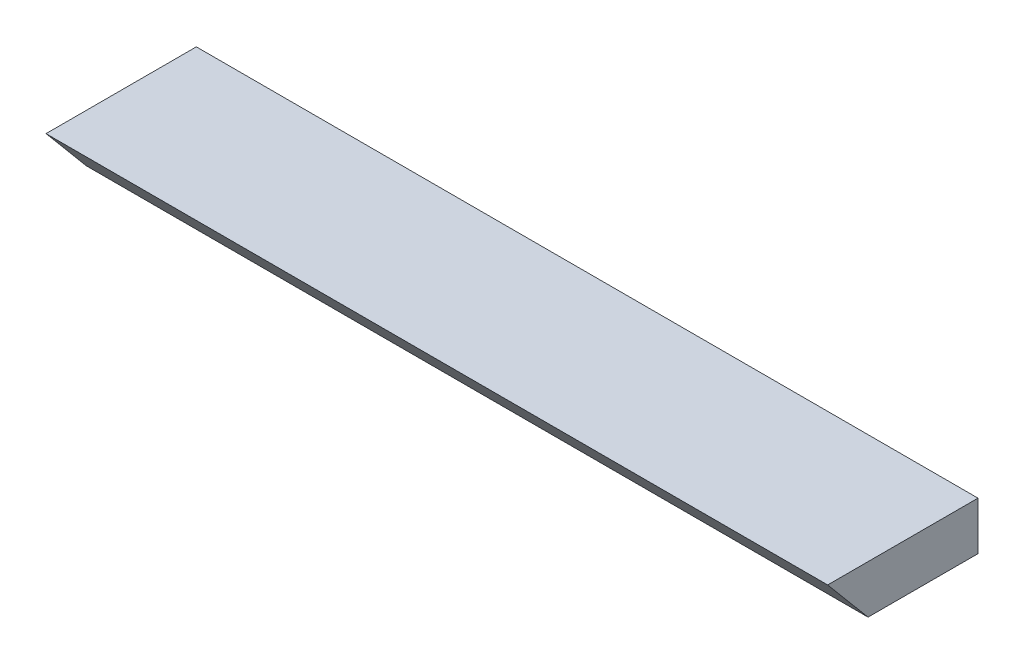
from build123d import *

# Parameters (mm, degrees)
EXTRUDE_1_DEPTH = 130


with BuildPart() as part:
    # Эскиз1 → Бобышка-Вытянуть1 (new body)
    with BuildSketch(Plane(origin=(0, 0, 0), x_dir=(0, 0, -1), z_dir=(1, 0, 0))):
        Polygon((-58.37070421, 0.245873463), (-65.083501259, 8.245873463), (-40.083501259, 8.245873463), (-40.083501259, 0.245873463), align=None)
    extrude(amount=EXTRUDE_1_DEPTH)


solid = part.part
